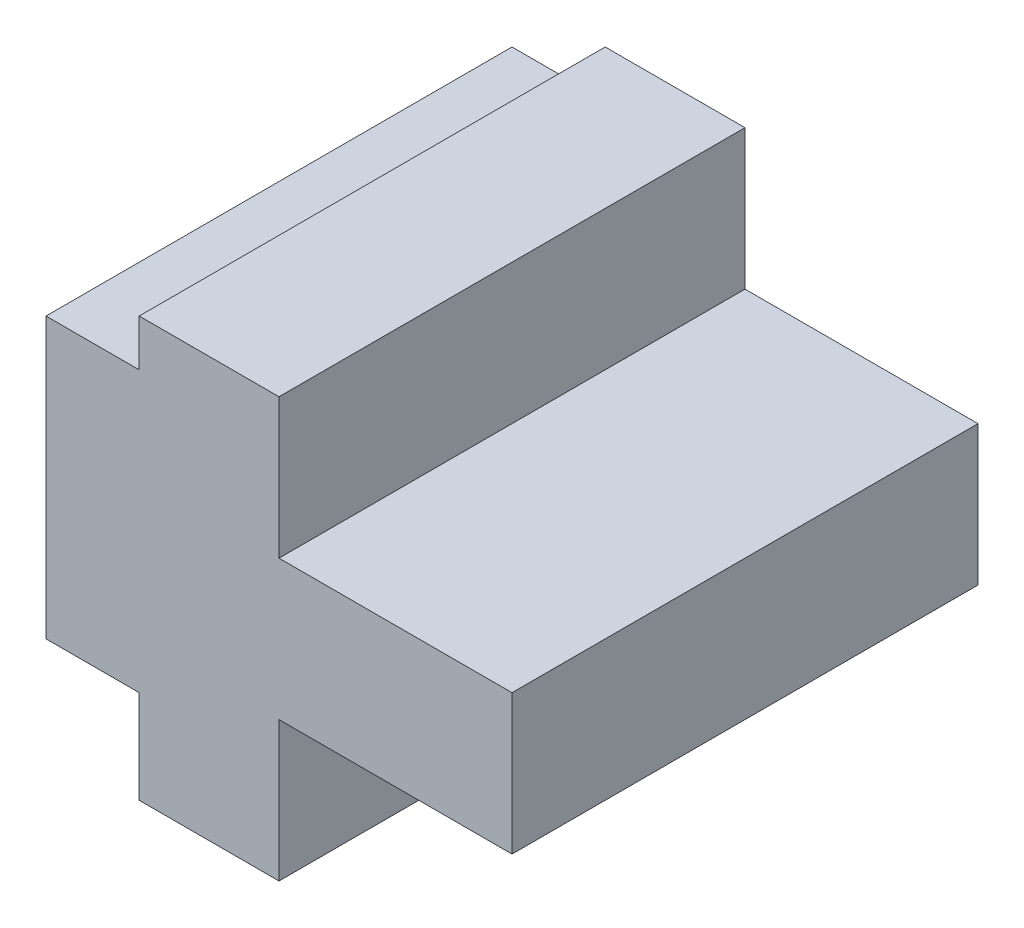
from build123d import *

# Parameters (mm, degrees)
BOSS_EXTRUDE1_DEPTH = 5


with BuildPart() as part:
    # Sketch1 → Boss-Extrude1 (new, symmetric)
    with BuildSketch(Plane.XY):
        Polygon((-5, 2), (-5, 8), (-3, 8), (-3, 9), (0, 9), (0, 6), (5, 6), (5, 3), (0, 3), (0, 0), (-3, 0), (-3, 2), align=None)
    extrude(amount=BOSS_EXTRUDE1_DEPTH, both=True)


solid = part.part
